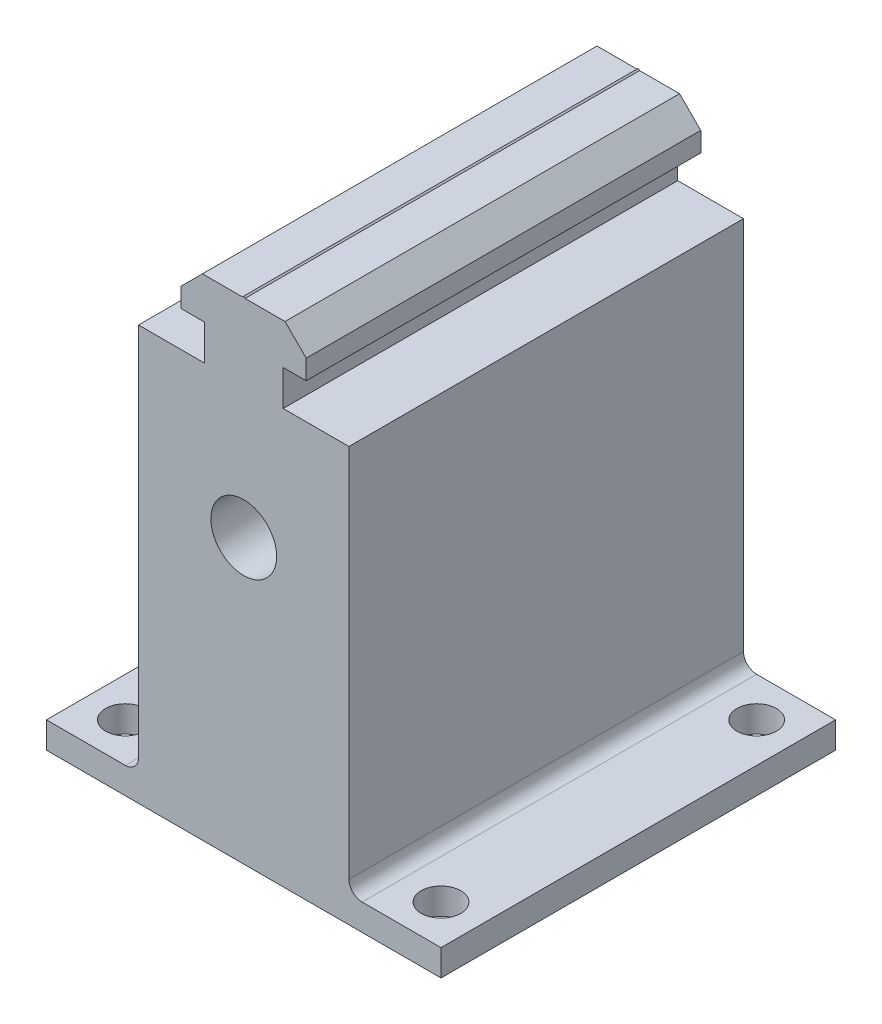
from build123d import *

# Parameters (mm, degrees)
SKETCH1_R           = 1.5
BOSS_EXTRUDE1_DEPTH = 2
SKETCH10_W          = 16
SKETCH10_H          = 30
BOSS_EXTRUDE2_DEPTH = 29.5
FILLET1_R           = 1
SKETCH11_R          = 2.5
CUT_EXTRUDE1_DEPTH  = 32.5
BOSS_EXTRUDE4_DEPTH = 30


with BuildPart() as part:
    # Sketch1 → Boss-Extrude1 (new body)
    # profile 1 of 5: a face of its own
    with BuildSketch(Plane(origin=(0, 0, 0), x_dir=(1, 0, 0), z_dir=(0, 1, 0))):
        with BuildLine():
            Line((-15, -7), (-15, -15))
            Line((-15, -15), (-7, -15))
            ThreePointArc((-7, -15), (-9.343145751, -9.343145751), (-15, -7))
        make_face()
        with Locations(Location((-12, -12, 0), (0, 0, 270))):
            Circle(SKETCH1_R, mode=Mode.SUBTRACT)
    # profile 2 of 5: a face of its own
    with BuildSketch(Plane(origin=(0, 0, 0), x_dir=(1, 0, 0), z_dir=(0, 1, 0))):
        with BuildLine():
            ThreePointArc((15, -7), (9.343145751, -9.343145751), (7, -15))
            Line((7, -15), (15, -15))
            Line((15, -15), (15, -7))
        make_face()
        with Locations(Location((12, -12, 0), (0, 0, 270))):
            Circle(SKETCH1_R, mode=Mode.SUBTRACT)
    # profile 3 of 5: a face of its own
    with BuildSketch(Plane(origin=(0, 0, 0), x_dir=(1, 0, 0), z_dir=(0, 1, 0))):
        with BuildLine():
            ThreePointArc((-15, -7), (-9.343145751, -9.343145751), (-7, -15))
            Line((-7, -15), (7, -15))
            ThreePointArc((7, -15), (9.343145751, -9.343145751), (15, -7))
            Line((15, -7), (15, 7))
            ThreePointArc((15, 7), (9.343145751, 9.343145751), (7, 15))
            Line((7, 15), (-7, 15))
            ThreePointArc((-7, 15), (-9.343145751, 9.343145751), (-15, 7))
            Line((-15, 7), (-15, -7))
        make_face()
    # profile 4 of 5: a face of its own
    with BuildSketch(Plane(origin=(0, 0, 0), x_dir=(1, 0, 0), z_dir=(0, 1, 0))):
        with BuildLine():
            ThreePointArc((7, 15), (9.343145751, 9.343145751), (15, 7))
            Line((15, 7), (15, 15))
            Line((15, 15), (7, 15))
        make_face()
        with Locations(Location((12, 12, 0), (0, 0, 270))):
            Circle(SKETCH1_R, mode=Mode.SUBTRACT)
    # profile 5 of 5: a face of its own
    with BuildSketch(Plane(origin=(0, 0, 0), x_dir=(1, 0, 0), z_dir=(0, 1, 0))):
        with BuildLine():
            Line((-15, 15), (-15, 7))
            ThreePointArc((-15, 7), (-9.343145751, 9.343145751), (-7, 15))
            Line((-7, 15), (-15, 15))
        make_face()
        with Locations(Location((-12, 12, 0), (0, 0, 270))):
            Circle(SKETCH1_R, mode=Mode.SUBTRACT)
    extrude(amount=BOSS_EXTRUDE1_DEPTH)

    # Sketch10 → Boss-Extrude2 (add)
    with BuildSketch(Plane(origin=(0, 2, 0), x_dir=(1, 0, 0), z_dir=(0, 1, 0))):
        Rectangle(SKETCH10_W, SKETCH10_H)
    extrude(amount=BOSS_EXTRUDE2_DEPTH)

    # Fillet1
    fillet1_edges = [part.edges().sort_by_distance(p)[0] for p in [
        (-8, 2, 0),
        (8, 2, 0),
    ]]
    fillet(fillet1_edges, radius=FILLET1_R)

    # Sketch11 → Cut-Extrude1 (cut)
    with BuildSketch(Plane.XY.offset(15)):
        with Locations((0, 21.5)):
            Circle(SKETCH11_R)
    extrude(amount=-CUT_EXTRUDE1_DEPTH, mode=Mode.SUBTRACT)

    # Sketch13 → Boss-Extrude4 (add)
    with BuildSketch(Plane.XY.offset(15)):
        Polygon((-4.75, 34.2), (-3, 34.2), (-3, 33.3), (-3, 33.25), (-3, 31.5), (3, 31.5), (3, 33.25), (3, 33.3), (3, 34.2), (4.75, 34.2), (4.75, 35.689339828), (3.139339828, 37.3), (0.1, 37.3), (0, 37.4), (-0.1, 37.3), (-3.139339828, 37.3), (-4.75, 35.689339828), align=None)
    extrude(amount=-BOSS_EXTRUDE4_DEPTH)


solid = part.part
